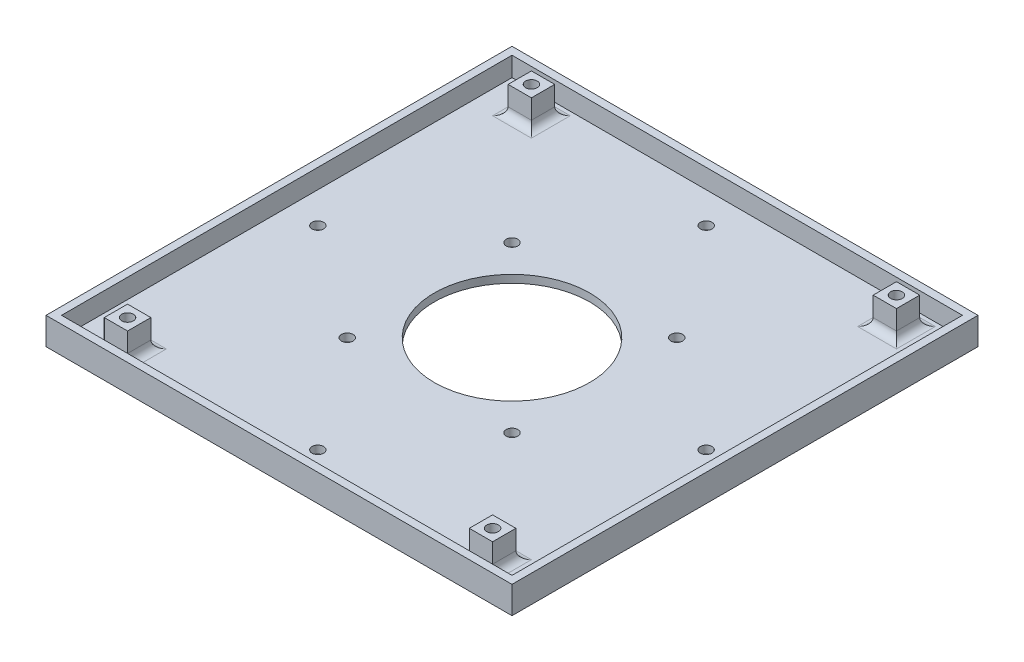
from build123d import *

# Parameters (mm, degrees)
SKETCH1_W           = 116
SKETCH1_H           = 116
SKETCH1_R           = 1.5
SKETCH1_R_2         = 20
BOSS_EXTRUDE1_DEPTH = 2
SKETCH2_W           = 6
SKETCH2_H           = 6
SKETCH2_R           = 1.5
BOSS_EXTRUDE2_DEPTH = 7
SKETCH1_4_W         = 120
SKETCH1_4_H         = 120
SKETCH1_4_W_2       = 116
SKETCH1_4_H_2       = 116
BOSS_EXTRUDE3_DEPTH = 7
SKETCH3_R           = 1.5
CUT_EXTRUDE1_DEPTH  = 86.141059425
FILLET2_R           = 2


with BuildPart() as part:
    # Sketch1 → Boss-Extrude1 (new body)
    with BuildSketch(Plane(origin=(0, 0, 0), x_dir=(1, 0, 0), z_dir=(0, 1, 0))):
        Rectangle(SKETCH1_W, SKETCH1_H)
        with Locations((-21.213203436, -21.213203436)):
            Circle(SKETCH1_R, mode=Mode.SUBTRACT)
        with Locations((21.213203436, -21.213203436)):
            Circle(SKETCH1_R, mode=Mode.SUBTRACT)
        Circle(SKETCH1_R_2, mode=Mode.SUBTRACT)
        with Locations((-21.213203436, 21.213203436)):
            Circle(SKETCH1_R, mode=Mode.SUBTRACT)
        with Locations((21.213203436, 21.213203436)):
            Circle(SKETCH1_R, mode=Mode.SUBTRACT)
    extrude(amount=BOSS_EXTRUDE1_DEPTH)

    # Sketch2 → Boss-Extrude2 (add)
    # profile 1 of 4: a face of its own
    with BuildSketch(Plane(origin=(0, 2, 0), x_dir=(1, 0, 0), z_dir=(0, 1, 0))):
        with Locations((47, 52)):
            Rectangle(SKETCH2_W, SKETCH2_H)
        with Locations((47, 52)):
            Circle(SKETCH2_R, mode=Mode.SUBTRACT)
    # profile 2 of 4: a face of its own
    with BuildSketch(Plane(origin=(0, 2, 0), x_dir=(1, 0, 0), z_dir=(0, 1, 0))):
        with Locations((47, -52)):
            Rectangle(SKETCH2_W, SKETCH2_H)
        with Locations((47, -52)):
            Circle(SKETCH2_R, mode=Mode.SUBTRACT)
    # profile 3 of 4: a face of its own
    with BuildSketch(Plane(origin=(0, 2, 0), x_dir=(1, 0, 0), z_dir=(0, 1, 0))):
        with Locations((-47, 52)):
            Rectangle(SKETCH2_W, SKETCH2_H)
        with Locations((-47, 52)):
            Circle(SKETCH2_R, mode=Mode.SUBTRACT)
    # profile 4 of 4: a face of its own
    with BuildSketch(Plane(origin=(0, 2, 0), x_dir=(1, 0, 0), z_dir=(0, 1, 0))):
        with Locations((-47, -52)):
            Rectangle(SKETCH2_W, SKETCH2_H)
        with Locations((-47, -52)):
            Circle(SKETCH2_R, mode=Mode.SUBTRACT)
    extrude(amount=BOSS_EXTRUDE2_DEPTH)

    # Sketch1<4> → Boss-Extrude3 (add)
    with BuildSketch(Plane(origin=(0, 0, 0), x_dir=(1, 0, 0), z_dir=(0, 1, 0))):
        Rectangle(SKETCH1_4_W, SKETCH1_4_H)
        Rectangle(SKETCH1_4_W_2, SKETCH1_4_H_2, mode=Mode.SUBTRACT)
    extrude(amount=BOSS_EXTRUDE3_DEPTH)

    # Sketch3 → Cut-Extrude1 (cut, through all)
    with BuildSketch(Plane(origin=(0, 2, 0), x_dir=(1, 0, 0), z_dir=(0, 1, 0))):
        with Locations((50, 0)):
            Circle(SKETCH3_R)
        with Locations((-50, 0)):
            Circle(SKETCH3_R)
        with Locations((0, -50)):
            Circle(SKETCH3_R)
        with Locations((0, 50)):
            Circle(SKETCH3_R)
    extrude(amount=-CUT_EXTRUDE1_DEPTH, mode=Mode.SUBTRACT)

    # Fillet2
    fillet2_edges = [part.edges().sort_by_distance(p)[0] for p in [
        (-47, 2, 49),
        (-50, 2, 52),
        (-47, 2, 55),
        (-44, 2, 52),
        (50, 2, 52),
        (47, 2, 55),
        (47, 2, 49),
        (44, 2, 52),
        (47, 2, -55),
        (44, 2, -52),
        (47, 2, -49),
        (50, 2, -52),
        (-47, 2, -55),
        (-44, 2, -52),
        (-50, 2, -52),
        (-47, 2, -49),
    ]]
    fillet(fillet2_edges, radius=FILLET2_R)


solid = part.part
